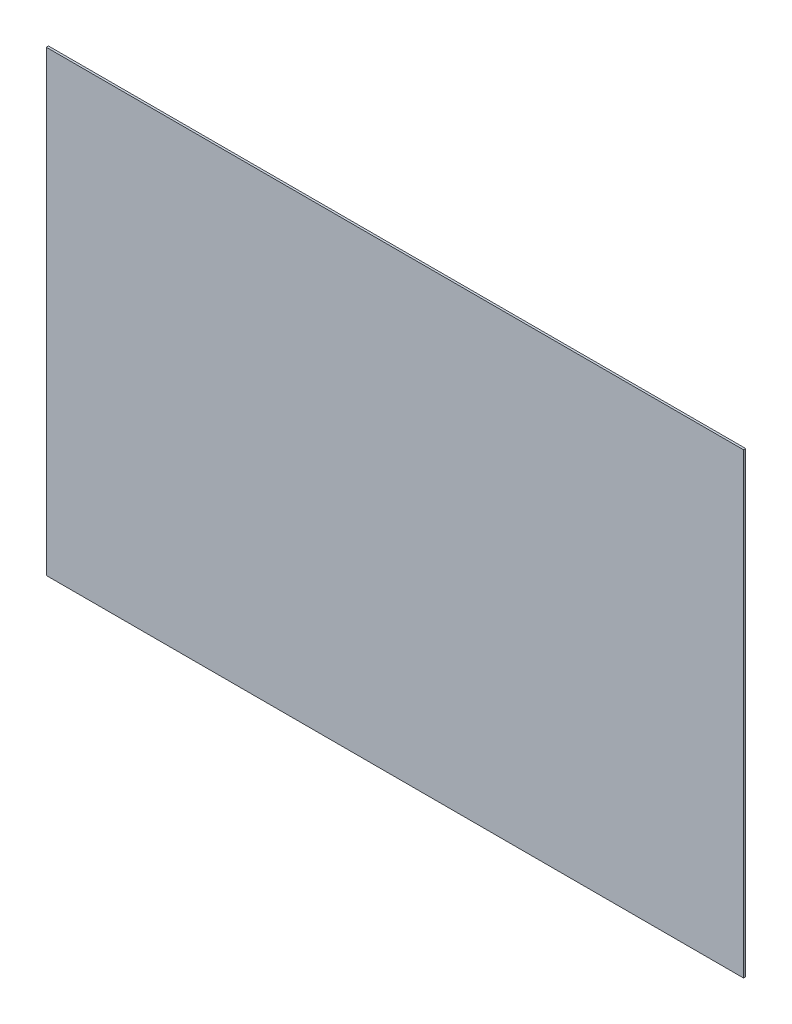
from build123d import *

# Parameters (mm, degrees)
SKETCH_1_W      = 320
SKETCH_1_H      = 210
EXTRUDE_1_DEPTH = 1


with BuildPart() as part:
    # 草图1 → 凸台-拉伸1 (new body)
    with BuildSketch(Plane.XY):
        with Locations((-160, 105)):
            Rectangle(SKETCH_1_W, SKETCH_1_H)
    extrude(amount=EXTRUDE_1_DEPTH)


solid = part.part
